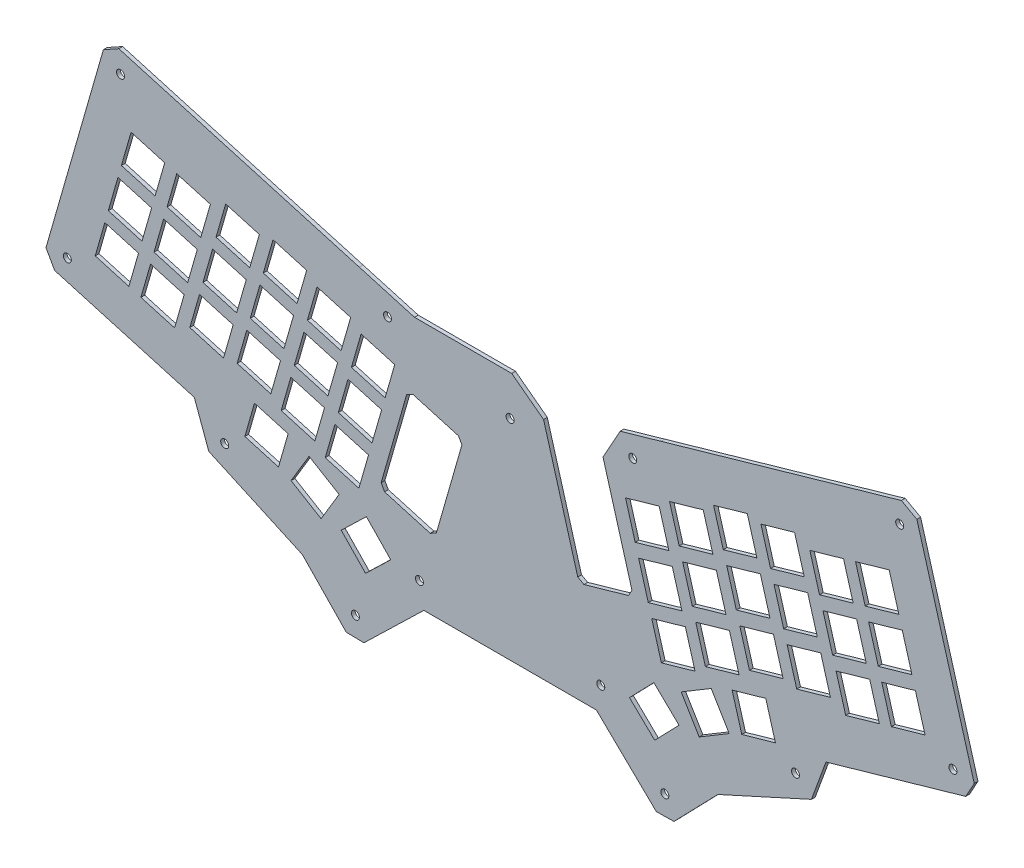
from build123d import *

# Parameters (mm, degrees)
ESQUISSE1_R        = 1.6
BOSS_EXTRU_1_DEPTH = 1.5


with BuildPart() as part:
    # Esquisse1 → Boss.-Extru.1 (new body)
    with BuildSketch(Plane.XY):
        Polygon((-102.267806075, -134.437972545), (-84.723821109, -116.319052626), (-47.296900898, -99.298065073), (-41.491708262, -83.459404935), (14.381168218, -67.438115415), (17.809289919, -61.253620157), (-5.137146777, 18.770114611), (-11.32171868, 22.19850363), (-107.454535032, -5.36135166), (-114.180015808, -7.289852239), (-123.793577085, -10.046496577), (-130.649820486, -22.415487094), (-119.070790786, -62.796362516), (-120.442039466, -65.27016062), (-138.268849115, -70.381916029), (-140.742647218, -69.010667349), (-154.419403971, -21.314148304), (-167.175777529, -11.701531345), (-206.025150502, -11.701531345), (-221.410503936, -7.289852239), (-228.135984711, -5.36135166), (-324.268801063, 22.19850363), (-330.453372966, 18.770114611), (-353.399809662, -61.253620157), (-349.971687961, -67.438115415), (-294.098811481, -83.459404935), (-288.293618845, -99.298065073), (-250.866698634, -116.319052626), (-233.322713669, -134.437972545), (-226.255271496, -134.549159576), (-202.296830677, -111.350948678), (-133.293689066, -111.350948678), (-109.335248247, -134.549159576), align=None)
        with Locations((-12.000450916, 13.68165837)):
            Circle(ESQUISSE1_R, mode=Mode.SUBTRACT)
        with Locations((-118.757933777, -16.924131519)):
            Circle(ESQUISSE1_R, mode=Mode.SUBTRACT)
        with Locations((9.292284284, -60.574933915)):
            Circle(ESQUISSE1_R, mode=Mode.SUBTRACT)
        with Locations((-53.656180266, -93.401689518)):
            Circle(ESQUISSE1_R, mode=Mode.SUBTRACT)
        with Locations((-105.923928137, -126.713325795)):
            Circle(ESQUISSE1_R, mode=Mode.SUBTRACT)
        with Locations((-131.530967037, -101.880200807)):
            Circle(ESQUISSE1_R, mode=Mode.SUBTRACT)
        with Locations(Location((-204.059552706, -101.880200807, 0), (0, 0, 180))):
            Circle(ESQUISSE1_R, mode=Mode.SUBTRACT)
        with Locations(Location((-229.666591606, -126.713325795, 0), (0, 0, 180))):
            Circle(ESQUISSE1_R, mode=Mode.SUBTRACT)
        with Locations(Location((-281.934339477, -93.401689518, 0), (0, 0, 180))):
            Circle(ESQUISSE1_R, mode=Mode.SUBTRACT)
        with Locations(Location((-344.882804027, -60.574933915, 0), (0, 0, 180))):
            Circle(ESQUISSE1_R, mode=Mode.SUBTRACT)
        with Locations(Location((-216.832585966, -16.924131519, 0), (0, 0, 180))):
            Circle(ESQUISSE1_R, mode=Mode.SUBTRACT)
        with Locations(Location((-323.590068827, 13.68165837, 0), (0, 0, 180))):
            Circle(ESQUISSE1_R, mode=Mode.SUBTRACT)
        with Locations(Location((-167.795259872, -27.605548894, 0), (0, 0, 180))):
            Circle(ESQUISSE1_R, mode=Mode.SUBTRACT)
        Polygon((-121.646075908, -32.047544313), (-108.187467847, -28.188350553), (-104.328274087, -41.646958614), (-117.786882148, -45.506152375), align=None, mode=Mode.SUBTRACT)
        Polygon((-100.176299623, -37.98551269), (-104.035493384, -24.526904628), (-90.576885322, -20.667710868), (-86.717691562, -34.126318929), align=None, mode=Mode.SUBTRACT)
        Polygon((-82.565717099, -30.464873005), (-86.424910859, -17.006264943), (-72.966302798, -13.147071183), (-69.107109038, -26.605679244), align=None, mode=Mode.SUBTRACT)
        Polygon((-63.645764268, -27.510550239), (-67.504958028, -14.051942178), (-54.046349967, -10.192748417), (-50.187156207, -23.651356479), align=None, mode=Mode.SUBTRACT)
        Polygon((-44.071126284, -26.839385933), (-47.930320044, -13.380777872), (-34.471711983, -9.521584111), (-30.612518223, -22.980192173), align=None, mode=Mode.SUBTRACT)
        Polygon((-25.805370251, -21.601764674), (-29.664564011, -8.143156613), (-16.20595595, -4.283962852), (-12.346762189, -17.742570914), align=None, mode=Mode.SUBTRACT)
        Polygon((-116.408594683, -50.312811991), (-102.949986622, -46.453618231), (-99.090792861, -59.912226292), (-112.549400923, -63.771420052), align=None, mode=Mode.SUBTRACT)
        Polygon((-98.798012158, -42.792172306), (-85.339404097, -38.932978546), (-81.480210337, -52.391586607), (-94.938818398, -56.250780367), align=None, mode=Mode.SUBTRACT)
        Polygon((-81.187429634, -35.271532621), (-67.728821573, -31.412338861), (-63.869627812, -44.870946922), (-77.328235874, -48.730140682), align=None, mode=Mode.SUBTRACT)
        Polygon((-62.267476803, -32.317209855), (-48.808868742, -28.458016095), (-44.949674981, -41.916624156), (-58.408283043, -45.775817917), align=None, mode=Mode.SUBTRACT)
        Polygon((-42.692838819, -31.646045549), (-29.234230758, -27.786851789), (-25.375036997, -41.24545985), (-38.833645059, -45.104653611), align=None, mode=Mode.SUBTRACT)
        Polygon((-24.427082786, -26.40842429), (-10.968474724, -22.54923053), (-7.109280964, -36.007838591), (-20.567889026, -39.867032352), align=None, mode=Mode.SUBTRACT)
        Polygon((-19.189601561, -44.673691968), (-5.730993499, -40.814498208), (-1.871799739, -54.273106269), (-15.3304078, -58.132300029), align=None, mode=Mode.SUBTRACT)
        Polygon((-37.455357594, -49.911313227), (-23.996749532, -46.052119467), (-20.137555772, -59.510727528), (-33.596163833, -63.369921288), align=None, mode=Mode.SUBTRACT)
        Polygon((-57.029995578, -50.582477533), (-43.571387516, -46.723283773), (-39.712193756, -60.181891834), (-53.170801817, -64.041085594), align=None, mode=Mode.SUBTRACT)
        Polygon((-75.949948409, -53.536800299), (-62.491340347, -49.677606538), (-58.632146587, -63.1362146), (-72.090754648, -66.99540836), align=None, mode=Mode.SUBTRACT)
        Polygon((-93.560530933, -61.057439984), (-80.101922872, -57.198246223), (-76.242729111, -70.656854285), (-89.701337173, -74.516048045), align=None, mode=Mode.SUBTRACT)
        Polygon((-111.171113458, -68.578079669), (-97.712505396, -64.718885908), (-93.853311636, -78.17749397), (-107.311919697, -82.03668773), align=None, mode=Mode.SUBTRACT)
        Polygon((-79.018130302, -77.304798222), (-65.559522241, -73.445604462), (-61.700328481, -86.904212523), (-75.158936542, -90.763406284), align=None, mode=Mode.SUBTRACT)
        Polygon((-99.400078923, -88.135090111), (-87.391574532, -80.936247863), (-80.192732283, -92.944752254), (-92.201236674, -100.143594502), align=None, mode=Mode.SUBTRACT)
        Polygon((-120.049818618, -100.436716825), (-110.317049076, -90.371891716), (-100.252223967, -100.104661258), (-109.984993509, -110.169486367), align=None, mode=Mode.SUBTRACT)
        Polygon((-225.605526235, -110.169486367), (-215.540701125, -100.436716825), (-225.273470667, -90.371891716), (-235.338295776, -100.104661258), align=None, mode=Mode.SUBTRACT)
        Polygon((-243.389283069, -100.143594502), (-236.19044082, -88.135090111), (-248.198945211, -80.936247863), (-255.39778746, -92.944752254), align=None, mode=Mode.SUBTRACT)
        Polygon((-260.431583201, -90.763406284), (-256.572389441, -77.304798222), (-270.030997502, -73.445604462), (-273.890191262, -86.904212523), align=None, mode=Mode.SUBTRACT)
        Polygon((-228.278600046, -82.03668773), (-224.419406286, -68.578079669), (-237.878014347, -64.718885908), (-241.737208107, -78.17749397), align=None, mode=Mode.SUBTRACT)
        Polygon((-245.88918257, -74.516048045), (-242.02998881, -61.057439984), (-255.488596871, -57.198246223), (-259.347790632, -70.656854285), align=None, mode=Mode.SUBTRACT)
        Polygon((-263.499765095, -66.99540836), (-259.640571335, -53.536800299), (-273.099179396, -49.677606538), (-276.958373156, -63.1362146), align=None, mode=Mode.SUBTRACT)
        Polygon((-282.419717926, -64.041085594), (-278.560524165, -50.582477533), (-292.019132227, -46.723283773), (-295.878325987, -60.181891834), align=None, mode=Mode.SUBTRACT)
        Polygon((-301.99435591, -63.369921288), (-298.135162149, -49.911313227), (-311.593770211, -46.052119467), (-315.452963971, -59.510727528), align=None, mode=Mode.SUBTRACT)
        Polygon((-320.260111943, -58.132300029), (-316.400918183, -44.673691968), (-329.859526244, -40.814498208), (-333.718720004, -54.273106269), align=None, mode=Mode.SUBTRACT)
        Polygon((-315.022630718, -39.867032352), (-311.163436957, -26.40842429), (-324.622045019, -22.54923053), (-328.481238779, -36.007838591), align=None, mode=Mode.SUBTRACT)
        Polygon((-296.756874684, -45.104653611), (-292.897680924, -31.646045549), (-306.356288985, -27.786851789), (-310.215482746, -41.24545985), align=None, mode=Mode.SUBTRACT)
        Polygon((-277.1822367, -45.775817917), (-273.32304294, -32.317209855), (-286.781651001, -28.458016095), (-290.640844762, -41.916624156), align=None, mode=Mode.SUBTRACT)
        Polygon((-258.26228387, -48.730140682), (-254.403090109, -35.271532621), (-267.861698171, -31.412338861), (-271.720891931, -44.870946922), align=None, mode=Mode.SUBTRACT)
        Polygon((-240.651701345, -56.250780367), (-236.792507585, -42.792172306), (-250.251115646, -38.932978546), (-254.110309406, -52.391586607), align=None, mode=Mode.SUBTRACT)
        Polygon((-223.041118821, -63.771420052), (-219.18192506, -50.312811991), (-232.640533122, -46.453618231), (-236.499726882, -59.912226292), align=None, mode=Mode.SUBTRACT)
        Polygon((-323.243757554, -17.742570914), (-309.785149492, -21.601764674), (-305.925955732, -8.143156613), (-319.384563793, -4.283962852), align=None, mode=Mode.SUBTRACT)
        Polygon((-304.97800152, -22.980192173), (-291.519393459, -26.839385933), (-287.660199699, -13.380777872), (-301.11880776, -9.521584111), align=None, mode=Mode.SUBTRACT)
        Polygon((-285.403363536, -23.651356479), (-271.944755475, -27.510550239), (-268.085561715, -14.051942178), (-281.544169776, -10.192748417), align=None, mode=Mode.SUBTRACT)
        Polygon((-266.483410706, -26.605679244), (-253.024802644, -30.464873005), (-249.165608884, -17.006264943), (-262.624216945, -13.147071183), align=None, mode=Mode.SUBTRACT)
        Polygon((-248.872828181, -34.126318929), (-235.41422012, -37.98551269), (-231.555026359, -24.526904628), (-245.013634421, -20.667710868), align=None, mode=Mode.SUBTRACT)
        Polygon((-217.803637595, -45.506152375), (-213.944443835, -32.047544313), (-227.403051896, -28.188350553), (-231.262245657, -41.646958614), align=None, mode=Mode.SUBTRACT)
        Polygon((-197.274945207, -82.010279702), (-187.078341197, -46.443029785), (-188.449727462, -43.969307951), (-206.713990933, -38.733214), (-209.187712767, -40.104600265), (-219.384316777, -75.671850182), (-218.012930512, -78.145572016), (-199.748667041, -83.381665967), align=None, mode=Mode.SUBTRACT)
    extrude(amount=BOSS_EXTRU_1_DEPTH)


solid = part.part
